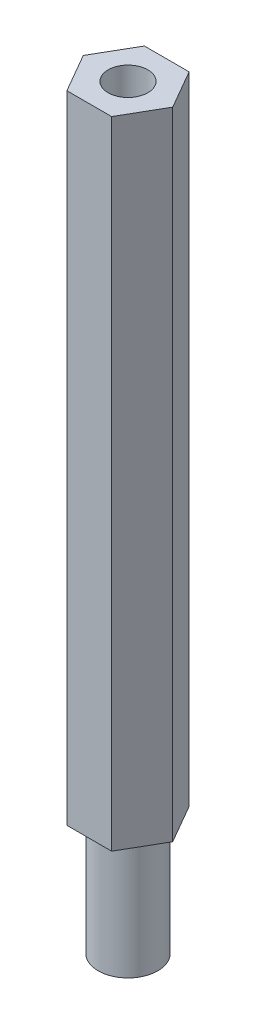
from build123d import *

# Parameters (mm, degrees)
EXTRUDE_1_DEPTH     = 32
SKETCH_2_R          = 1.5
EXTRUDE_2_DEPTH     = 6
SKETCH_3_R          = 1
CUT_EXTRUDE_1_DEPTH = 10


with BuildPart() as part:
    # 草图1 → 凸台-拉伸1 (new body)
    with BuildSketch(Plane(origin=(0, 0, 0), x_dir=(1, 0, 0), z_dir=(0, 1, 0))):
        Polygon((2.25, 0), (1.125, 1.948557159), (-1.125, 1.948557159), (-2.25, 0), (-1.125, -1.948557159), (1.125, -1.948557159), align=None)
    extrude(amount=EXTRUDE_1_DEPTH)

    # 草图2 → 凸台-拉伸2 (add)
    with BuildSketch(Plane.XZ):
        with Locations(Location((0, 0, 0), (0, 0, 270))):
            Circle(SKETCH_2_R)
    extrude(amount=EXTRUDE_2_DEPTH)

    # 草图3 → 切除-拉伸1 (cut)
    with BuildSketch(Plane(origin=(0, 32, 0), x_dir=(1, 0, 0), z_dir=(0, 1, 0))):
        with Locations(Location((0, 0, 0), (0, 0, 270))):
            Circle(SKETCH_3_R)
    extrude(amount=-CUT_EXTRUDE_1_DEPTH, mode=Mode.SUBTRACT)


solid = part.part
